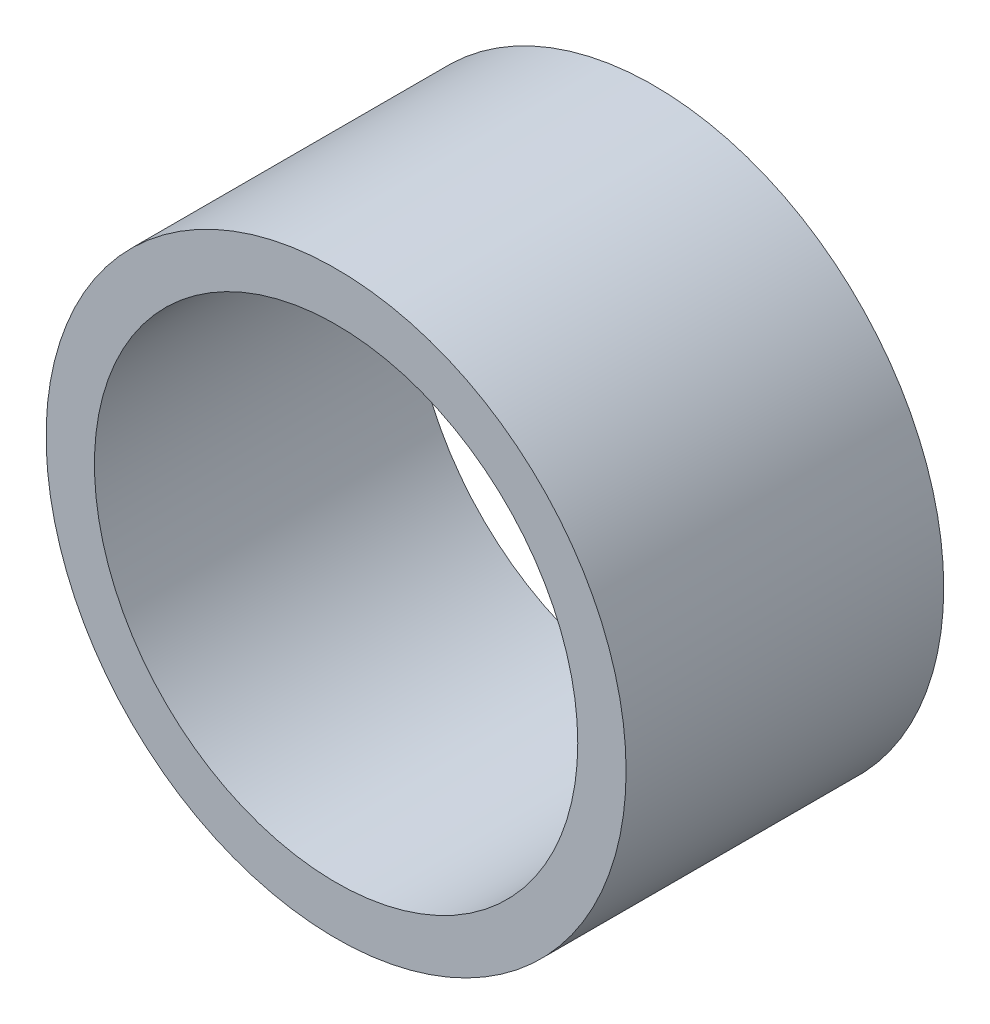
from build123d import *

# Parameters (mm, degrees)
SKETCH1_R           = 21
SKETCH1_R_2         = 17.5
BOSS_EXTRUDE1_DEPTH = 23


with BuildPart() as part:
    # Sketch1 → Boss-Extrude1 (new body)
    with BuildSketch(Plane.XY):
        Circle(SKETCH1_R)
        Circle(SKETCH1_R_2, mode=Mode.SUBTRACT)
    extrude(amount=BOSS_EXTRUDE1_DEPTH)


solid = part.part
